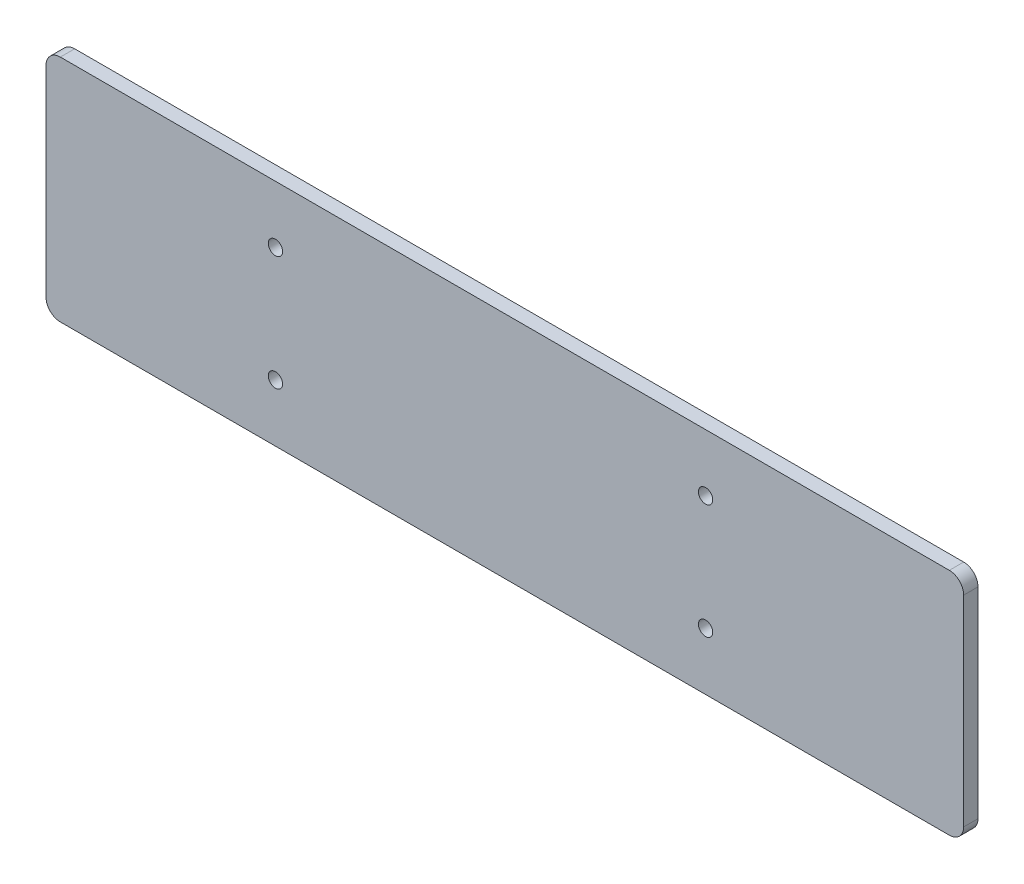
from build123d import *

# Parameters (mm, degrees)
SKETCH1_W           = 320
SKETCH1_H           = 80
SKETCH1_R           = 2.5
BOSS_EXTRUDE1_DEPTH = 5
FILLET1_R           = 5


with BuildPart() as part:
    # Sketch1 → Boss-Extrude1 (new body)
    with BuildSketch(Plane.XY):
        with Locations((-50, 0)):
            Rectangle(SKETCH1_W, SKETCH1_H)
        with Locations((-130, -20)):
            Circle(SKETCH1_R, mode=Mode.SUBTRACT)
        with Locations((-130, 20)):
            Circle(SKETCH1_R, mode=Mode.SUBTRACT)
        with Locations((20, 20)):
            Circle(SKETCH1_R, mode=Mode.SUBTRACT)
        with Locations((20, -20)):
            Circle(SKETCH1_R, mode=Mode.SUBTRACT)
    extrude(amount=BOSS_EXTRUDE1_DEPTH)

    # Fillet1
    fillet1_edges = [part.edges().sort_by_distance(p)[0] for p in [
        (-210, 40, 2.5),
        (110, 40, 2.5),
        (110, -40, 2.5),
        (-210, -40, 2.5),
    ]]
    fillet(fillet1_edges, radius=FILLET1_R)


solid = part.part
